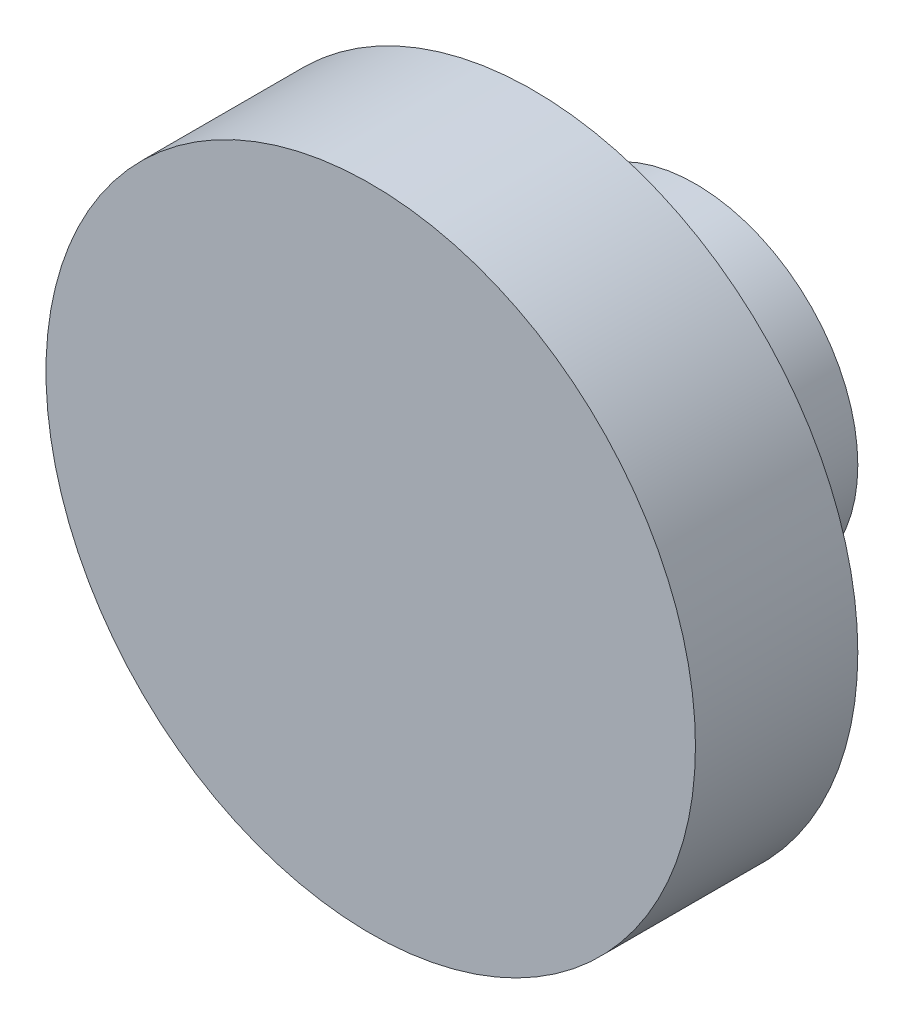
from build123d import *

# Parameters (mm, degrees)
SKETCH1_R           = 15
SKETCH1_R_2         = 7.5
BOSS_EXTRUDE1_DEPTH = 15
SKETCH2_R           = 30
BOSS_EXTRUDE2_DEPTH = 15


with BuildPart() as part:
    # Sketch1 → Boss-Extrude1 (new body)
    with BuildSketch(Plane.XY):
        Circle(SKETCH1_R)
        Circle(SKETCH1_R_2, mode=Mode.SUBTRACT)
    extrude(amount=BOSS_EXTRUDE1_DEPTH)

    # Sketch2 → Boss-Extrude2 (add)
    with BuildSketch(Plane.XY.offset(15)):
        Circle(SKETCH2_R)
    extrude(amount=BOSS_EXTRUDE2_DEPTH)


solid = part.part
